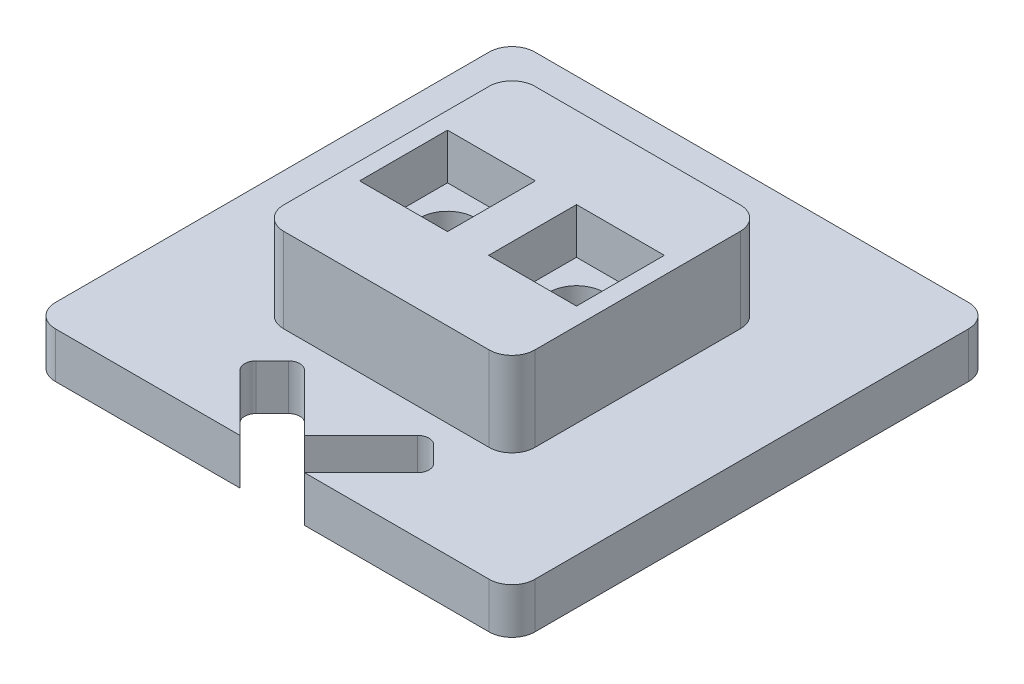
from build123d import *
from build123d.topology import SkipClean

# Parameters (mm, degrees)
SKETCH1_W           = 11
SKETCH1_H           = 11
BOSS_EXTRUDE1_DEPTH = 3.7
FILLET1_R           = 1
SKETCH2_W           = 3.85
SKETCH2_H           = 3.85
CUT_EXTRUDE1_DEPTH  = 2
SKETCH4_R           = 2.2
BOSS_EXTRUDE2_DEPTH = 2
BOSS_EXTRUDE3_DEPTH = 2
SKETCH3_R           = 1.2
CUT_EXTRUDE2_DEPTH  = 16.90565937
CUT_EXTRUDE3_DEPTH  = 16.303267625
SKETCH8_R           = 2.2
SKETCH8_R_2         = 1.2
BOSS_EXTRUDE4_DEPTH = 4


with BuildPart() as part:
    # Sketch1 → Boss-Extrude1 (new body)
    with BuildSketch(Plane(origin=(0, 0, 0), x_dir=(1, 0, 0), z_dir=(0, 1, 0))):
        Rectangle(SKETCH1_W, SKETCH1_H)
    extrude(amount=BOSS_EXTRUDE1_DEPTH)

    # Fillet1
    fillet1_edges = [part.edges().sort_by_distance(p)[0] for p in [
        (5.5, 1.85, 5.5),
        (-5.5, 1.85, 5.5),
        (-5.5, 1.85, -5.5),
        (5.5, 1.85, -5.5),
    ]]
    fillet(fillet1_edges, radius=FILLET1_R)

    # Sketch2 → Cut-Extrude1 (cut)
    with BuildSketch(Plane(origin=(0, 3.7, 0), x_dir=(1, 0, 0), z_dir=(0, 1, 0))):
        with Locations((-2.825, 0)):
            Rectangle(SKETCH2_W, SKETCH2_H)
        with Locations((2.825, 0)):
            Rectangle(SKETCH2_W, SKETCH2_H)
    extrude(amount=-CUT_EXTRUDE1_DEPTH, mode=Mode.SUBTRACT)

    # Sketch4 → Boss-Extrude2 (add)
    with BuildSketch(Plane(origin=(0, 0, 0), x_dir=(-1, 0, 0), z_dir=(0, -1, 0))):
        with Locations(Location((2.825, 0, 0), (0, 0, 90))):
            Circle(SKETCH4_R)
        with Locations(Location((-2.825, 0, 0), (0, 0, 90))):
            Circle(SKETCH4_R)
    extrude(amount=BOSS_EXTRUDE2_DEPTH)

    # Sketch5 → Boss-Extrude3 (add)
    with BuildSketch(Plane(origin=(0, -2, 0), x_dir=(-1, 0, 0), z_dir=(0, -1, 0))):
        with BuildLine():
            Line((9.5, 10.5), (-9.5, 10.5))
            ThreePointArc((-9.5, 10.5), (-10.207106781, 10.207106781), (-10.5, 9.5))
            Line((-10.5, 9.5), (-10.5, -9.5))
            ThreePointArc((-10.5, -9.5), (-10.207106781, -10.207106781), (-9.5, -10.5))
            Line((-9.5, -10.5), (9.5, -10.5))
            ThreePointArc((9.5, -10.5), (10.207106781, -10.207106781), (10.5, -9.5))
            Line((10.5, -9.5), (10.5, 9.5))
            ThreePointArc((10.5, 9.5), (10.207106781, 10.207106781), (9.5, 10.5))
        make_face()
    extrude(amount=-BOSS_EXTRUDE3_DEPTH)

    # Sketch3 → Cut-Extrude2 (cut, through all)
    with BuildSketch(Plane(origin=(0, 3.7, 0), x_dir=(1, 0, 0), z_dir=(0, 1, 0))):
        with Locations(Location((-2.825, 0, 0), (0, 0, 270))):
            Circle(SKETCH3_R)
        with Locations(Location((2.825, 0, 0), (0, 0, 270))):
            Circle(SKETCH3_R)
    extrude(amount=-CUT_EXTRUDE2_DEPTH, mode=Mode.SUBTRACT)

    # Sketch7 → Cut-Extrude3 (cut, through all)
    with BuildSketch(Plane(origin=(0, 0, 0), x_dir=(1, 0, 0), z_dir=(0, 1, 0))):
        with BuildLine():
            Line((0, -9.085786438), (1.414213562, -10.5))
            Line((1.414213562, -10.5), (3.889087297, -8.025126266))
            ThreePointArc((3.889087297, -8.025126266), (4.035533906, -7.671572875), (3.889087297, -7.318019485))
            Line((3.889087297, -7.318019485), (3.181980515, -6.610912703))
            ThreePointArc((3.181980515, -6.610912703), (2.828427125, -6.464466094), (2.474873734, -6.610912703))
            Line((2.474873734, -6.610912703), (0, -9.085786438))
        make_face()
        with BuildLine():
            Line((-3.889087297, -8.025126266), (-1.414213562, -10.5))
            Line((-1.414213562, -10.5), (0, -9.085786438))
            Line((0, -9.085786438), (-2.474873734, -6.610912703))
            ThreePointArc((-2.474873734, -6.610912703), (-2.828427125, -6.464466094), (-3.181980515, -6.610912703))
            Line((-3.181980515, -6.610912703), (-3.889087297, -7.318019485))
            ThreePointArc((-3.889087297, -7.318019485), (-4.035533906, -7.671572875), (-3.889087297, -8.025126266))
        make_face()
        Polygon((-1.414213562, -10.5), (1.414213562, -10.5), (0, -9.085786438), align=None)
    extrude(amount=-CUT_EXTRUDE3_DEPTH, mode=Mode.SUBTRACT)

    # Sketch8 → Boss-Extrude4 (add)
    # profile 1 of 2: a face of its own
    with SkipClean():  # the faces are left unmerged after this step: merging them gives an invalid solid
        with BuildSketch(Plane.XZ.offset(2)):
            with Locations(Location((-2.825, 0, 0), (0, 0, 270))):
                Circle(SKETCH8_R)
            with Locations(Location((-2.825, 0, 0), (0, 0, 270))):
                Circle(SKETCH8_R_2, mode=Mode.SUBTRACT)
        # profile 2 of 2: a face of its own
        with BuildSketch(Plane.XZ.offset(2)):
            with Locations(Location((2.825, 0, 0), (0, 0, 270))):
                Circle(SKETCH8_R)
            with Locations(Location((2.825, 0, 0), (0, 0, 270))):
                Circle(SKETCH8_R_2, mode=Mode.SUBTRACT)
        extrude(amount=BOSS_EXTRUDE4_DEPTH)


solid = part.part
